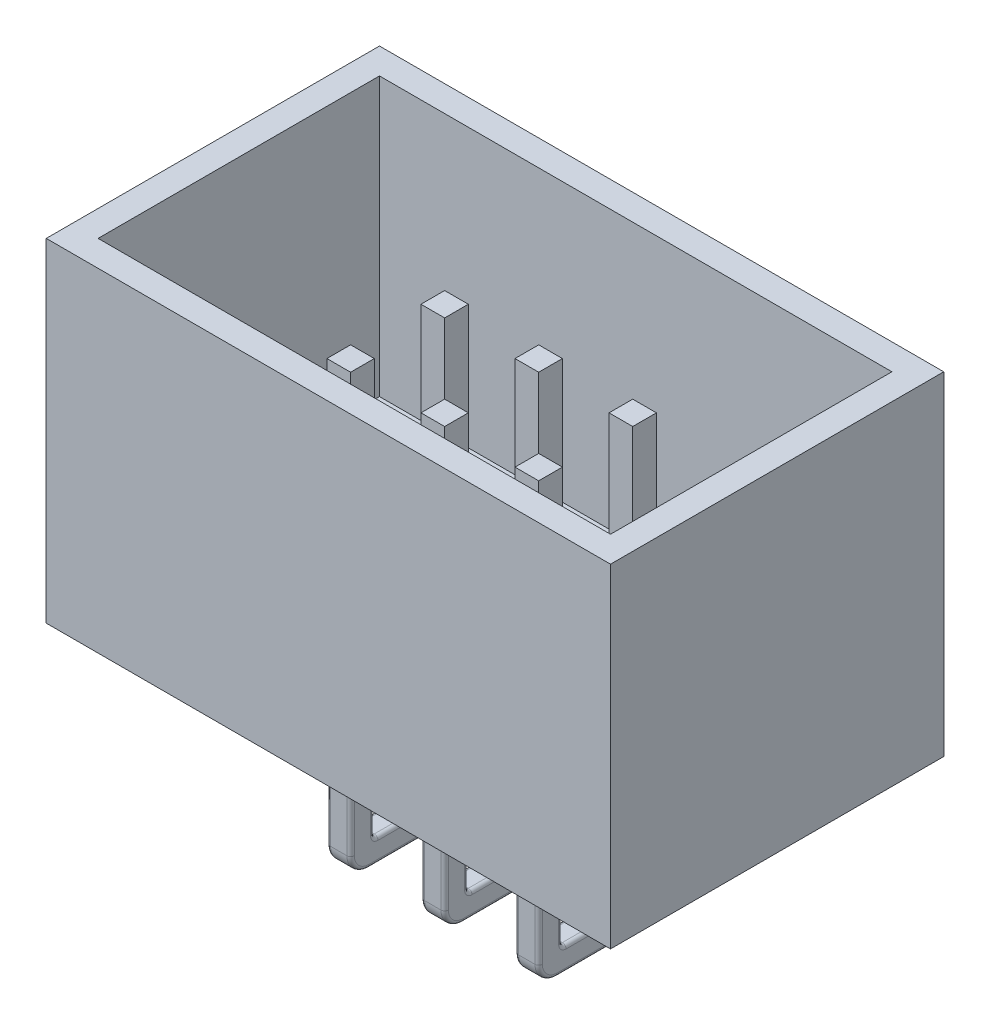
from build123d import *

# Parameters (mm, degrees)
SKIZZE1_W                            = 15.24
SKIZZE1_H                            = 9
COMPONENT_OUTLINE_DEPTH              = 9
SKIZZE2_W                            = 13.84
SKIZZE2_H                            = 7.6
SCHNITT_LINEAR_AUSTRAGEN1_DEPTH      = 7.5
AUFSATZ_LINEAR_AUSTRAGEN1_DEPTH      = 2.16
AUFSATZ_LINEAR_AUSTRAGEN1_DEPTH_BACK = 7.16
SKIZZE3_W                            = 0.64
SKIZZE3_H                            = 0.64
SKIZZE5_W                            = 0.64
SKIZZE5_H                            = 0.64
AUFSATZ_LINEAR_AUSTRAGEN2_DEPTH      = 2.54
SKIZZE4_W                            = 0.64
SKIZZE4_H                            = 0.64
AUFSATZ_LINEAR_AUSTRAGEN3_DEPTH      = 6
SKIZZE6_W                            = 0.64
SKIZZE6_H                            = 0.64
AUFSATZ_LINEAR_AUSTRAGEN4_DEPTH      = 8.54
VERRUNDUNG1_R                        = 0.5
VERRUNDUNG2_R                        = 0.1


with BuildPart() as part:
    # Skizze1 → Component_Outline (new body)
    with BuildSketch(Plane.XY):
        with Locations((0, 6.422)):
            Rectangle(SKIZZE1_W, SKIZZE1_H)
    extrude(amount=COMPONENT_OUTLINE_DEPTH)

    # Skizze2 → Schnitt-Linear austragen1 (cut)
    with BuildSketch(Plane(origin=(0, 10.922, 0), x_dir=(1, 0, 0), z_dir=(0, 1, 0))):
        with Locations((0, -4.5)):
            Rectangle(SKIZZE2_W, SKIZZE2_H)
    extrude(amount=-SCHNITT_LINEAR_AUSTRAGEN1_DEPTH, mode=Mode.SUBTRACT)

    # Skizze3 → Aufsatz-Linear austragen1 (add, two sides: drawn at the far end of the back side and taken through both)
    with BuildSketch(Plane.XZ.offset(-1.922).offset(-AUFSATZ_LINEAR_AUSTRAGEN1_DEPTH_BACK)):
        with Locations((0, 3.32)):
            Rectangle(SKIZZE3_W, SKIZZE3_H)
        with Locations((0, 5.86)):
            Rectangle(SKIZZE3_W, SKIZZE3_H)
        with Locations((-2.54, 3.32)):
            Rectangle(SKIZZE3_W, SKIZZE3_H)
        with Locations((-2.54, 5.86)):
            Rectangle(SKIZZE3_W, SKIZZE3_H)
        with Locations((2.54, 3.32)):
            Rectangle(SKIZZE3_W, SKIZZE3_H)
        with Locations((2.54, 5.86)):
            Rectangle(SKIZZE3_W, SKIZZE3_H)
    extrude(amount=AUFSATZ_LINEAR_AUSTRAGEN1_DEPTH + AUFSATZ_LINEAR_AUSTRAGEN1_DEPTH_BACK)

    # Skizze5 → Aufsatz-Linear austragen2 (add)
    with BuildSketch(Plane.XZ.offset(0.238)):
        with Locations((-2.54, 5.86)):
            Rectangle(SKIZZE5_W, SKIZZE5_H)
        with Locations((0, 5.86)):
            Rectangle(SKIZZE5_W, SKIZZE5_H)
        with Locations((2.54, 5.86)):
            Rectangle(SKIZZE5_W, SKIZZE5_H)
    extrude(amount=AUFSATZ_LINEAR_AUSTRAGEN2_DEPTH)

    # Skizze4 → Aufsatz-Linear austragen3 (add)
    with BuildSketch(Plane(origin=(0, 0, 3), x_dir=(-1, 0, 0), z_dir=(0, 0, -1))):
        with Locations((2.54, 0.082)):
            Rectangle(SKIZZE4_W, SKIZZE4_H)
        with Locations((0, 0.082)):
            Rectangle(SKIZZE4_W, SKIZZE4_H)
        with Locations((-2.54, 0.082)):
            Rectangle(SKIZZE4_W, SKIZZE4_H)
    extrude(amount=AUFSATZ_LINEAR_AUSTRAGEN3_DEPTH)

    # Skizze6 → Aufsatz-Linear austragen4 (add)
    with BuildSketch(Plane(origin=(0, 0, 5.54), x_dir=(-1, 0, 0), z_dir=(0, 0, -1))):
        with Locations((2.54, -2.458)):
            Rectangle(SKIZZE6_W, SKIZZE6_H)
        with Locations((0, -2.458)):
            Rectangle(SKIZZE6_W, SKIZZE6_H)
        with Locations((-2.54, -2.458)):
            Rectangle(SKIZZE6_W, SKIZZE6_H)
    extrude(amount=AUFSATZ_LINEAR_AUSTRAGEN4_DEPTH)

    # Verrundung1
    verrundung1_edges = [part.edges().sort_by_distance(p)[0] for p in [
        (2.54, -0.238, 3.64),
        (-2.54, -2.778, 6.18),
        (0, -2.778, 6.18),
        (2.54, -2.778, 6.18),
        (0, -0.238, 3.64),
        (-2.54, -0.238, 3.64),
    ]]
    fillet(verrundung1_edges, radius=VERRUNDUNG1_R)

    # Verrundung2
    verrundung2_edges = [part.edges().sort_by_distance(p)[0] for p in [
        (2.86, 1.092, 3.64),
        (2.86, 1.922, 3.32),
        (2.86, 1.162, 3),
        (2.54, 1.922, 3),
        (2.22, 1.162, 3),
        (2.22, 1.922, 3.32),
        (2.22, 1.092, 3.64),
        (2.54, 1.922, 3.64),
        (2.86, -0.238, 0.07),
        (2.86, -0.178, 6.18),
        (2.86, 1.922, 5.86),
        (2.86, -0.108, 5.54),
        (2.54, 1.922, 5.54),
        (2.22, -0.108, 5.54),
        (2.22, 1.922, 5.86),
        (2.22, -0.178, 6.18),
        (2.54, 1.922, 6.18),
        (-2.22, -2.778, 1.34),
        (0.32, -2.778, 1.34),
        (2.86, -2.778, 1.34),
        (-2.86, 0.402, 0),
        (-2.54, 0.402, 3),
        (-2.22, 0.402, 0),
        (-2.54, -0.238, -3),
        (-2.86, 0.082, -3),
        (-2.54, 0.402, -3),
        (-2.22, 0.082, -3),
        (-0.32, 0.402, 0),
        (0, 0.402, 3),
        (0.32, 0.402, 0),
        (0, -0.238, -3),
        (-0.32, 0.082, -3),
        (0, 0.402, -3),
        (0.32, 0.082, -3),
        (2.22, 0.402, 0),
        (2.54, 0.402, 3),
        (2.86, 0.402, 0),
        (2.54, -0.238, -3),
        (2.22, 0.082, -3),
        (2.54, 0.402, -3),
        (2.86, 0.082, -3),
        (-2.86, -2.138, 1.27),
        (-2.54, -2.138, 5.54),
        (-2.22, -2.138, 1.27),
        (-2.54, -2.778, -3),
        (-2.86, -2.458, -3),
        (-2.54, -2.138, -3),
        (-2.22, -2.458, -3),
        (-0.32, -2.138, 1.27),
        (0, -2.138, 5.54),
        (0.32, -2.138, 1.27),
        (0, -2.778, -3),
        (-0.32, -2.458, -3),
        (0, -2.138, -3),
        (0.32, -2.458, -3),
        (2.22, -2.138, 1.27),
        (2.54, -2.138, 5.54),
        (2.86, -2.138, 1.27),
        (2.54, -2.778, -3),
        (2.22, -2.458, -3),
        (2.54, -2.138, -3),
        (2.86, -2.458, -3),
        (-2.86, -2.778, 1.34),
        (-2.86, -2.631553391, 6.033553391),
        (-2.22, -2.631553391, 6.033553391),
        (-0.32, -2.778, 1.34),
        (-0.32, -2.631553391, 6.033553391),
        (0.32, -2.631553391, 6.033553391),
        (2.22, -2.778, 1.34),
        (2.22, -2.631553391, 6.033553391),
        (2.86, -2.631553391, 6.033553391),
        (2.22, -0.238, 0.07),
        (2.22, -0.091553391, 3.493553391),
        (2.86, -0.091553391, 3.493553391),
        (-0.32, -0.238, 0.07),
        (-0.32, -0.091553391, 3.493553391),
        (0.32, -0.091553391, 3.493553391),
        (-2.86, -0.238, 0.07),
        (-2.86, -0.091553391, 3.493553391),
        (-2.22, -0.091553391, 3.493553391),
        (0.32, 1.092, 3.64),
        (0.32, 1.922, 3.32),
        (0.32, 1.162, 3),
        (0, 1.922, 3),
        (-0.32, 1.162, 3),
        (-0.32, 1.922, 3.32),
        (-0.32, 1.092, 3.64),
        (0, 1.922, 3.64),
        (0.32, -0.238, 0.07),
        (0.32, -0.178, 6.18),
        (0.32, 1.922, 5.86),
        (0.32, -0.108, 5.54),
        (0, 1.922, 5.54),
        (-0.32, -0.108, 5.54),
        (-0.32, 1.922, 5.86),
        (-0.32, -0.178, 6.18),
        (0, 1.922, 6.18),
        (-2.22, 1.092, 3.64),
        (-2.22, 1.922, 3.32),
        (-2.22, 1.162, 3),
        (-2.54, 1.922, 3),
        (-2.86, 1.162, 3),
        (-2.86, 1.922, 3.32),
        (-2.86, 1.092, 3.64),
        (-2.54, 1.922, 3.64),
        (-2.22, -0.238, 0.07),
        (-2.22, -0.178, 6.18),
        (-2.22, 1.922, 5.86),
        (-2.22, -0.108, 5.54),
        (-2.54, 1.922, 5.54),
        (-2.86, -0.108, 5.54),
        (-2.86, 1.922, 5.86),
        (-2.86, -0.178, 6.18),
        (-2.54, 1.922, 6.18),
    ]]
    fillet(verrundung2_edges, radius=VERRUNDUNG2_R)


solid = part.part
